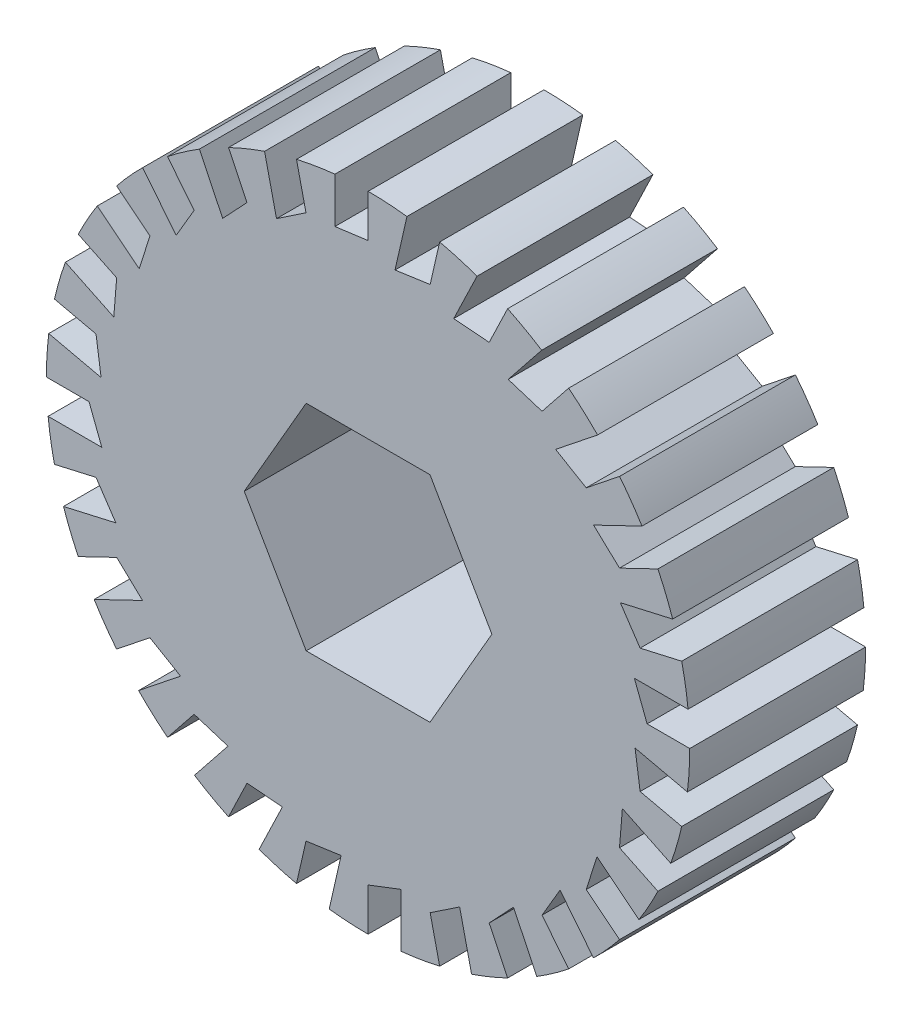
from build123d import *

# Parameters (mm, degrees)
SKETCH1_R           = 19.05
BOSS_EXTRUDE1_DEPTH = 10.414
CUT_EXTRUDE1_DEPTH  = 10.414
CUT_EXTRUDE2_START  = -127
CUT_EXTRUDE2_DEPTH  = 127


with BuildPart() as part:
    # Sketch1 → Boss-Extrude1 (new body)
    with BuildSketch(Plane.XY):
        Circle(SKETCH1_R)
    extrude(amount=BOSS_EXTRUDE1_DEPTH)

    # Sketch2 → Cut-Extrude1 (cut)
    with BuildSketch(Plane.XY.offset(10.414)):
        Polygon((-7.332348419, 0), (-3.666174209, -6.35), (3.666174209, -6.35), (7.332348419, 0), (3.666174209, 6.35), (-3.666174209, 6.35), align=None)
    extrude(amount=-CUT_EXTRUDE1_DEPTH, mode=Mode.SUBTRACT)

    # Sketch3 → Cut-Extrude2 (cut)
    with BuildSketch(Plane.XY.offset(10.414).offset(CUT_EXTRUDE2_START)):
        with BuildLine():
            Line((0, 19.05), (0, 16.525205144))
            Line((0, 16.525205144), (-1.963187207, 16.262621871))
            Line((-1.963187207, 16.262621871), (-1.963187207, 18.9485724))
            ThreePointArc((-1.963187207, 18.9485724), (-0.982902788, 19.024626202), (0, 19.05))
        make_face()
        with BuildLine():
            Line((3.677204083, 16.11088375), (1.595179024, 15.811419173))
            Line((1.595179024, 15.811419173), (2.302488023, 18.910342379))
            ThreePointArc((2.302488023, 18.910342379), (3.275118227, 18.766355549), (4.239023792, 18.572376727))
            Line((4.239023792, 18.572376727), (3.677204083, 16.11088375))
        make_face()
        with BuildLine():
            Line((7.170017798, 14.888695371), (5.073556317, 15.060033157))
            Line((5.073556317, 15.060033157), (6.452706889, 17.923868829))
            ThreePointArc((6.452706889, 17.923868829), (7.368911139, 17.567061468), (8.26548523, 17.163456934))
            Line((8.26548523, 17.163456934), (7.170017798, 14.888695371))
        make_face()
        with BuildLine():
            Line((10.303296881, 12.919925636), (8.297524311, 13.553474193))
            Line((8.297524311, 13.553474193), (10.279360087, 16.038617653))
            ThreePointArc((10.279360087, 16.038617653), (11.093196077, 15.486881571), (11.877480725, 14.893889741))
            Line((11.877480725, 14.893889741), (10.303296881, 12.919925636))
        make_face()
        with BuildLine():
            Line((12.919925636, 10.303296881), (11.105419788, 11.367287439))
            Line((11.105419788, 11.367287439), (13.590563248, 13.349123215))
            ThreePointArc((13.590563248, 13.349123215), (14.261221842, 12.630124765), (14.893889741, 11.877480725))
            Line((14.893889741, 11.877480725), (12.919925636, 10.303296881))
        make_face()
        with BuildLine():
            Line((14.888695371, 7.170017798), (13.356443146, 8.611097427))
            Line((13.356443146, 8.611097427), (16.220278818, 9.990247999))
            ThreePointArc((16.220278818, 9.990247999), (16.714130394, 9.140040764), (17.163456934, 8.26548523))
            Line((17.163456934, 8.26548523), (14.888695371, 7.170017798))
        make_face()
        with BuildLine():
            Line((16.11088375, 3.677204083), (14.937718672, 5.423111033))
            Line((14.937718672, 5.423111033), (18.036641878, 6.130420032))
            ThreePointArc((18.036641878, 6.130420032), (18.328922656, 5.191636954), (18.572376727, 4.239023792))
            Line((18.572376727, 4.239023792), (16.11088375, 3.677204083))
        make_face()
        with BuildLine():
            Line((16.525205144, 0), (15.76995461, 1.963187207))
            Line((15.76995461, 1.963187207), (18.9485724, 1.963187207))
            ThreePointArc((18.9485724, 1.963187207), (19.024626202, 0.982902788), (19.05, 0))
            Line((19.05, 0), (16.525205144, 0))
        make_face()
        with BuildLine():
            Line((16.11088375, -3.677204083), (15.811419173, -1.595179024))
            Line((15.811419173, -1.595179024), (18.910342379, -2.302488023))
            ThreePointArc((18.910342379, -2.302488023), (18.766355549, -3.275118227), (18.572376727, -4.239023792))
            Line((18.572376727, -4.239023792), (16.11088375, -3.677204083))
        make_face()
        with BuildLine():
            Line((14.888695371, -7.170017798), (15.060033157, -5.073556317))
            Line((15.060033157, -5.073556317), (17.923868829, -6.452706889))
            ThreePointArc((17.923868829, -6.452706889), (17.567061468, -7.368911139), (17.163456934, -8.26548523))
            Line((17.163456934, -8.26548523), (14.888695371, -7.170017798))
        make_face()
        with BuildLine():
            Line((12.919925636, -10.303296881), (13.553474193, -8.297524311))
            Line((13.553474193, -8.297524311), (16.038617653, -10.279360087))
            ThreePointArc((16.038617653, -10.279360087), (15.486881571, -11.093196077), (14.893889741, -11.877480725))
            Line((14.893889741, -11.877480725), (12.919925636, -10.303296881))
        make_face()
        with BuildLine():
            Line((10.303296881, -12.919925636), (11.367287439, -11.105419788))
            Line((11.367287439, -11.105419788), (13.349123215, -13.590563248))
            ThreePointArc((13.349123215, -13.590563248), (12.630124765, -14.261221842), (11.877480725, -14.893889741))
            Line((11.877480725, -14.893889741), (10.303296881, -12.919925636))
        make_face()
        with BuildLine():
            Line((7.170017798, -14.888695371), (8.611097427, -13.356443146))
            Line((8.611097427, -13.356443146), (9.990247999, -16.220278818))
            ThreePointArc((9.990247999, -16.220278818), (9.140040764, -16.714130394), (8.26548523, -17.163456934))
            Line((8.26548523, -17.163456934), (7.170017798, -14.888695371))
        make_face()
        with BuildLine():
            Line((3.677204083, -16.11088375), (5.423111033, -14.937718672))
            Line((5.423111033, -14.937718672), (6.130420032, -18.036641878))
            ThreePointArc((6.130420032, -18.036641878), (5.191636954, -18.328922656), (4.239023792, -18.572376727))
            Line((4.239023792, -18.572376727), (3.677204083, -16.11088375))
        make_face()
        with BuildLine():
            Line((0, -16.525205144), (1.963187207, -15.76995461))
            Line((1.963187207, -15.76995461), (1.963187207, -18.9485724))
            ThreePointArc((1.963187207, -18.9485724), (0.982902788, -19.024626202), (0, -19.05))
            Line((0, -19.05), (0, -16.525205144))
        make_face()
        with BuildLine():
            Line((-3.677204083, -16.11088375), (-1.595179024, -15.811419173))
            Line((-1.595179024, -15.811419173), (-2.302488023, -18.910342379))
            ThreePointArc((-2.302488023, -18.910342379), (-3.275118227, -18.766355549), (-4.239023792, -18.572376727))
            Line((-4.239023792, -18.572376727), (-3.677204083, -16.11088375))
        make_face()
        with BuildLine():
            Line((-7.170017798, -14.888695371), (-5.073556317, -15.060033157))
            Line((-5.073556317, -15.060033157), (-6.452706889, -17.923868829))
            ThreePointArc((-6.452706889, -17.923868829), (-7.368911139, -17.567061468), (-8.26548523, -17.163456934))
            Line((-8.26548523, -17.163456934), (-7.170017798, -14.888695371))
        make_face()
        with BuildLine():
            Line((-10.303296881, -12.919925636), (-8.297524311, -13.553474193))
            Line((-8.297524311, -13.553474193), (-10.279360087, -16.038617653))
            ThreePointArc((-10.279360087, -16.038617653), (-11.093196077, -15.486881571), (-11.877480725, -14.893889741))
            Line((-11.877480725, -14.893889741), (-10.303296881, -12.919925636))
        make_face()
        with BuildLine():
            Line((-12.919925636, -10.303296881), (-11.105419788, -11.367287439))
            Line((-11.105419788, -11.367287439), (-13.590563248, -13.349123215))
            ThreePointArc((-13.590563248, -13.349123215), (-14.261221842, -12.630124765), (-14.893889741, -11.877480725))
            Line((-14.893889741, -11.877480725), (-12.919925636, -10.303296881))
        make_face()
        with BuildLine():
            Line((-14.888695371, -7.170017798), (-13.356443146, -8.611097427))
            Line((-13.356443146, -8.611097427), (-16.220278818, -9.990247999))
            ThreePointArc((-16.220278818, -9.990247999), (-16.714130394, -9.140040764), (-17.163456934, -8.26548523))
            Line((-17.163456934, -8.26548523), (-14.888695371, -7.170017798))
        make_face()
        with BuildLine():
            Line((-16.11088375, -3.677204083), (-14.937718672, -5.423111033))
            Line((-14.937718672, -5.423111033), (-18.036641878, -6.130420032))
            ThreePointArc((-18.036641878, -6.130420032), (-18.328922656, -5.191636954), (-18.572376727, -4.239023792))
            Line((-18.572376727, -4.239023792), (-16.11088375, -3.677204083))
        make_face()
        with BuildLine():
            Line((-16.525205144, 0), (-15.76995461, -1.963187207))
            Line((-15.76995461, -1.963187207), (-18.9485724, -1.963187207))
            ThreePointArc((-18.9485724, -1.963187207), (-19.024626202, -0.982902788), (-19.05, 0))
            Line((-19.05, 0), (-16.525205144, 0))
        make_face()
        with BuildLine():
            Line((-16.11088375, 3.677204083), (-15.811419173, 1.595179024))
            Line((-15.811419173, 1.595179024), (-18.910342379, 2.302488023))
            ThreePointArc((-18.910342379, 2.302488023), (-18.766355549, 3.275118227), (-18.572376727, 4.239023792))
            Line((-18.572376727, 4.239023792), (-16.11088375, 3.677204083))
        make_face()
        with BuildLine():
            Line((-14.888695371, 7.170017798), (-15.060033157, 5.073556317))
            Line((-15.060033157, 5.073556317), (-17.923868829, 6.452706889))
            ThreePointArc((-17.923868829, 6.452706889), (-17.567061468, 7.368911139), (-17.163456934, 8.26548523))
            Line((-17.163456934, 8.26548523), (-14.888695371, 7.170017798))
        make_face()
        with BuildLine():
            Line((-12.919925636, 10.303296881), (-13.553474193, 8.297524311))
            Line((-13.553474193, 8.297524311), (-16.038617653, 10.279360087))
            ThreePointArc((-16.038617653, 10.279360087), (-15.486881571, 11.093196077), (-14.893889741, 11.877480725))
            Line((-14.893889741, 11.877480725), (-12.919925636, 10.303296881))
        make_face()
        with BuildLine():
            Line((-10.303296881, 12.919925636), (-11.367287439, 11.105419788))
            Line((-11.367287439, 11.105419788), (-13.349123215, 13.590563248))
            ThreePointArc((-13.349123215, 13.590563248), (-12.630124765, 14.261221842), (-11.877480725, 14.893889741))
            Line((-11.877480725, 14.893889741), (-10.303296881, 12.919925636))
        make_face()
        with BuildLine():
            Line((-7.170017798, 14.888695371), (-8.611097427, 13.356443146))
            Line((-8.611097427, 13.356443146), (-9.990247999, 16.220278818))
            ThreePointArc((-9.990247999, 16.220278818), (-9.140040764, 16.714130394), (-8.26548523, 17.163456934))
            Line((-8.26548523, 17.163456934), (-7.170017798, 14.888695371))
        make_face()
        with BuildLine():
            Line((-3.677204083, 16.11088375), (-5.423111033, 14.937718672))
            Line((-5.423111033, 14.937718672), (-6.130420032, 18.036641878))
            ThreePointArc((-6.130420032, 18.036641878), (-5.191636954, 18.328922656), (-4.239023792, 18.572376727))
            Line((-4.239023792, 18.572376727), (-3.677204083, 16.11088375))
        make_face()
    extrude(amount=CUT_EXTRUDE2_DEPTH, mode=Mode.SUBTRACT)


solid = part.part
